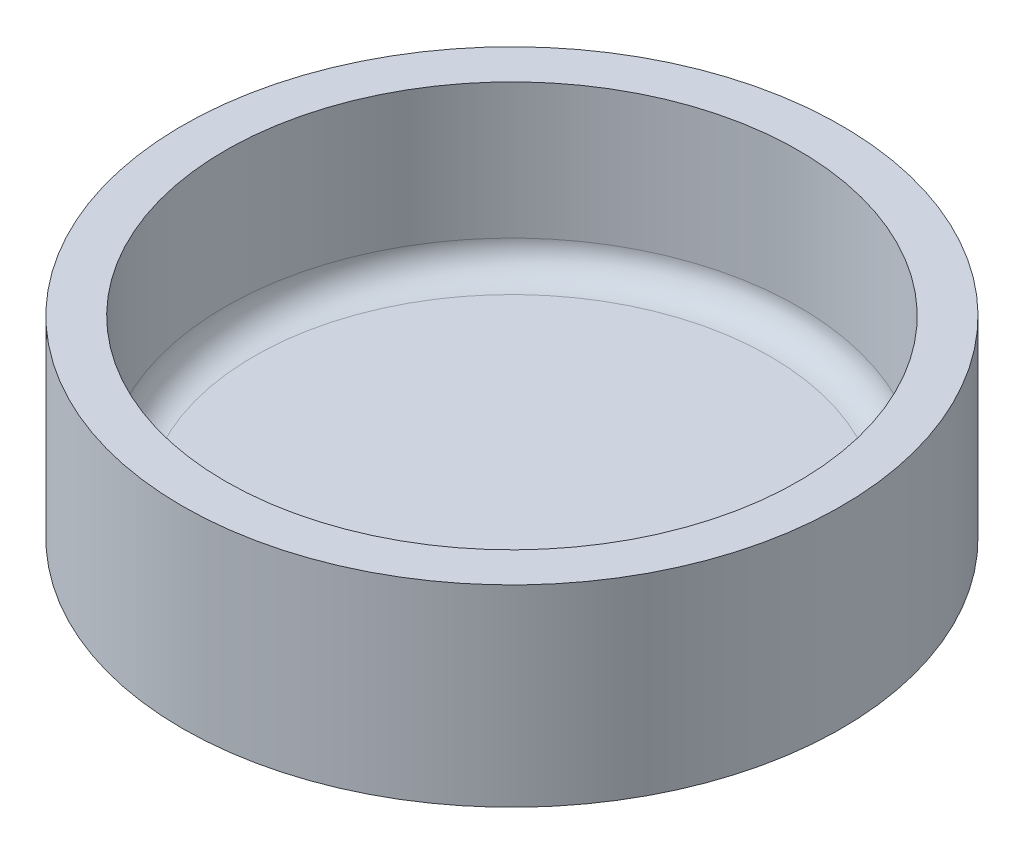
from build123d import *

# Parameters (mm, degrees)
SKETCH1_R           = 57.5
BOSS_EXTRUDE1_DEPTH = 33.6
SKETCH2_R           = 50
CUT_EXTRUDE1_DEPTH  = 28.6
FILLET1_R           = 5


with BuildPart() as part:
    # Sketch1 → Boss-Extrude1 (new body)
    with BuildSketch(Plane(origin=(0, 0, 0), x_dir=(1, 0, 0), z_dir=(0, 1, 0))):
        with Locations(Location((0, 0, 0), (0, 0, 270))):
            Circle(SKETCH1_R)
    extrude(amount=BOSS_EXTRUDE1_DEPTH)

    # Sketch2 → Cut-Extrude1 (cut)
    with BuildSketch(Plane(origin=(0, 33.6, 0), x_dir=(1, 0, 0), z_dir=(0, 1, 0))):
        with Locations(Location((0, 0, 0), (0, 0, 270))):
            Circle(SKETCH2_R)
    extrude(amount=-CUT_EXTRUDE1_DEPTH, mode=Mode.SUBTRACT)

    # Fillet1
    fillet1_edges = [part.edges().sort_by_distance(p)[0] for p in [
        (0, 5, -50),
    ]]
    fillet(fillet1_edges, radius=FILLET1_R)


solid = part.part
